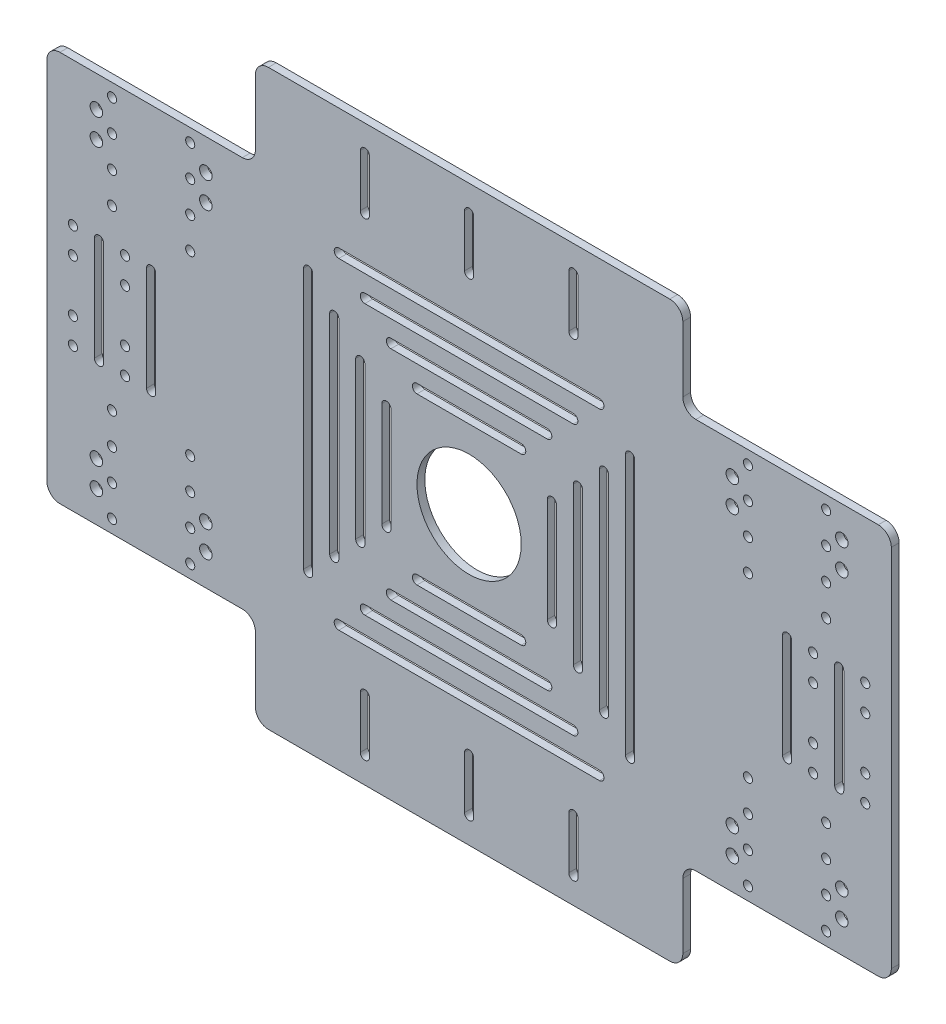
from build123d import *

# Parameters (mm, degrees)
SKETCH2_R           = 20
SKETCH2_R_2         = 1.75
SKETCH2_R_3         = 2.4
BOSS_EXTRUDE1_DEPTH = 3


with BuildPart() as part:
    # Sketch2 → Boss-Extrude1 (new body)
    with BuildSketch(Plane.XY):
        with BuildLine():
            Line((-124.210489142, 150.480737622), (-194.210489141, 150.480737622))
            ThreePointArc((-194.210489141, 150.480737622), (-197.746023047, 149.016271528), (-199.210489142, 145.480737623))
            Line((-199.210489142, 145.480737623), (-199.210489142, 76.980737622))
            Line((-199.210489142, 76.980737622), (-199.210489142, 5.480737623))
            ThreePointArc((-199.210489142, 5.480737623), (-197.746023048, 1.945203717), (-194.210489142, 0.480737622))
            Line((-194.210489142, 0.480737622), (-124.210489142, 0.480737622))
            ThreePointArc((-124.210489142, 0.480737622), (-120.674955236, -0.983728472), (-119.210489142, -4.519262377))
            Line((-119.210489142, -4.519262377), (-119.210489142, -29.519262378))
            ThreePointArc((-119.210489142, -29.519262378), (-117.746023048, -33.054796284), (-114.210489142, -34.519262378))
            Line((-114.210489142, -34.519262378), (-96.210489142, -34.519262378))
            Line((-96.210489142, -34.519262378), (39.789510858, -34.519262378))
            ThreePointArc((39.789510858, -34.519262378), (43.325044764, -33.054796284), (44.789510858, -29.519262378))
            Line((44.789510858, -29.519262378), (44.789510858, -4.519262378))
            ThreePointArc((44.789510858, -4.519262378), (46.253976952, -0.983728472), (49.789510858, 0.480737622))
            Line((49.789510858, 0.480737622), (119.789510858, 0.480737622))
            ThreePointArc((119.789510858, 0.480737622), (123.325044764, 1.945203716), (124.789510858, 5.480737622))
            Line((124.789510858, 5.480737622), (124.789510858, 76.980737622))
            Line((124.789510858, 76.980737622), (124.789510858, 145.480737622))
            ThreePointArc((124.789510858, 145.480737622), (123.325044764, 149.016271528), (119.789510858, 150.480737622))
            Line((119.789510858, 150.480737622), (49.789510858, 150.480737622))
            ThreePointArc((49.789510858, 150.480737622), (46.253976953, 151.945203716), (44.789510858, 155.480737622))
            Line((44.789510858, 155.480737622), (44.789510858, 180.480737622))
            ThreePointArc((44.789510858, 180.480737622), (43.325044764, 184.016271528), (39.789510858, 185.480737622))
            Line((39.789510858, 185.480737622), (-99.210489142, 185.480737622))
            Line((-99.210489142, 185.480737622), (-114.210489142, 185.480737622))
            ThreePointArc((-114.210489142, 185.480737622), (-117.746023048, 184.016271528), (-119.210489142, 180.480737622))
            Line((-119.210489142, 180.480737622), (-119.210489142, 155.480737622))
            ThreePointArc((-119.210489142, 155.480737622), (-120.674955236, 151.945203716), (-124.210489142, 150.480737622))
        make_face()
        with Locations((-37.210489142, 75.480737622)):
            Circle(SKETCH2_R, mode=Mode.SUBTRACT)
        with Locations((-144.210489142, 41.480737622)):
            Circle(SKETCH2_R_2, mode=Mode.SUBTRACT)
        with Locations((-144.210489142, 29.480737622)):
            Circle(SKETCH2_R_2, mode=Mode.SUBTRACT)
        with Locations((-144.210489142, 17.480737622)):
            Circle(SKETCH2_R_2, mode=Mode.SUBTRACT)
        with Locations((-144.210489142, 5.480737622)):
            Circle(SKETCH2_R_2, mode=Mode.SUBTRACT)
        with Locations((-138.210489142, 12.480737622)):
            Circle(SKETCH2_R_3, mode=Mode.SUBTRACT)
        with Locations((-138.210489142, 22.480737622)):
            Circle(SKETCH2_R_3, mode=Mode.SUBTRACT)
        with Locations((-180.210489142, 22.480737622)):
            Circle(SKETCH2_R_3, mode=Mode.SUBTRACT)
        with Locations((-180.210489142, 12.480737622)):
            Circle(SKETCH2_R_3, mode=Mode.SUBTRACT)
        with Locations((-174.210489142, 5.480737622)):
            Circle(SKETCH2_R_2, mode=Mode.SUBTRACT)
        with Locations((-174.210489142, 17.480737622)):
            Circle(SKETCH2_R_2, mode=Mode.SUBTRACT)
        with Locations((-174.210489142, 29.480737622)):
            Circle(SKETCH2_R_2, mode=Mode.SUBTRACT)
        with Locations((-174.210489142, 41.480737622)):
            Circle(SKETCH2_R_2, mode=Mode.SUBTRACT)
        with Locations((-189.210489142, 95.480737622)):
            Circle(SKETCH2_R_2, mode=Mode.SUBTRACT)
        with Locations((-189.210489142, 85.480737622)):
            Circle(SKETCH2_R_2, mode=Mode.SUBTRACT)
        with Locations((-189.210489142, 65.480737622)):
            Circle(SKETCH2_R_2, mode=Mode.SUBTRACT)
        with Locations((-189.210489142, 55.480737622)):
            Circle(SKETCH2_R_2, mode=Mode.SUBTRACT)
        with Locations((-169.210489142, 55.480737622)):
            Circle(SKETCH2_R_2, mode=Mode.SUBTRACT)
        with Locations((-169.210489142, 65.480737622)):
            Circle(SKETCH2_R_2, mode=Mode.SUBTRACT)
        with Locations((-169.210489142, 85.480737622)):
            Circle(SKETCH2_R_2, mode=Mode.SUBTRACT)
        with Locations((-169.210489142, 95.480737622)):
            Circle(SKETCH2_R_2, mode=Mode.SUBTRACT)
        with Locations((-138.210489142, 138.480737622)):
            Circle(SKETCH2_R_3, mode=Mode.SUBTRACT)
        with Locations((-144.210489142, 145.480737622)):
            Circle(SKETCH2_R_2, mode=Mode.SUBTRACT)
        with Locations((-144.210489142, 133.480737622)):
            Circle(SKETCH2_R_2, mode=Mode.SUBTRACT)
        with Locations((-138.210489142, 128.480737622)):
            Circle(SKETCH2_R_3, mode=Mode.SUBTRACT)
        with Locations((-144.210489142, 121.480737622)):
            Circle(SKETCH2_R_2, mode=Mode.SUBTRACT)
        with Locations((-144.210489142, 109.480737622)):
            Circle(SKETCH2_R_2, mode=Mode.SUBTRACT)
        with Locations((-174.210489142, 109.480737622)):
            Circle(SKETCH2_R_2, mode=Mode.SUBTRACT)
        with Locations((-174.210489142, 121.480737622)):
            Circle(SKETCH2_R_2, mode=Mode.SUBTRACT)
        with Locations((-180.210489142, 128.480737622)):
            Circle(SKETCH2_R_3, mode=Mode.SUBTRACT)
        with Locations((-174.210489142, 133.480737622)):
            Circle(SKETCH2_R_2, mode=Mode.SUBTRACT)
        with Locations((-180.210489142, 138.480737622)):
            Circle(SKETCH2_R_3, mode=Mode.SUBTRACT)
        with Locations((-174.210489142, 145.480737622)):
            Circle(SKETCH2_R_2, mode=Mode.SUBTRACT)
        with Locations((94.789510858, 55.480737622)):
            Circle(SKETCH2_R_2, mode=Mode.SUBTRACT)
        with Locations((94.789510858, 65.480737622)):
            Circle(SKETCH2_R_2, mode=Mode.SUBTRACT)
        with Locations((94.789510858, 95.480737622)):
            Circle(SKETCH2_R_2, mode=Mode.SUBTRACT)
        with Locations((94.789510858, 85.480737622)):
            Circle(SKETCH2_R_2, mode=Mode.SUBTRACT)
        with Locations((114.789510858, 55.480737622)):
            Circle(SKETCH2_R_2, mode=Mode.SUBTRACT)
        with Locations((114.789510858, 65.480737622)):
            Circle(SKETCH2_R_2, mode=Mode.SUBTRACT)
        with Locations((114.789510858, 85.480737622)):
            Circle(SKETCH2_R_2, mode=Mode.SUBTRACT)
        with Locations((114.789510858, 95.480737622)):
            Circle(SKETCH2_R_2, mode=Mode.SUBTRACT)
        with Locations((69.789510858, 121.480737622)):
            Circle(SKETCH2_R_2, mode=Mode.SUBTRACT)
        with Locations((69.789510858, 109.480737622)):
            Circle(SKETCH2_R_2, mode=Mode.SUBTRACT)
        with Locations((99.789510858, 109.480737622)):
            Circle(SKETCH2_R_2, mode=Mode.SUBTRACT)
        with Locations((99.789510858, 121.480737622)):
            Circle(SKETCH2_R_2, mode=Mode.SUBTRACT)
        with Locations((105.789510858, 128.480737622)):
            Circle(SKETCH2_R_3, mode=Mode.SUBTRACT)
        with Locations((99.789510858, 133.480737622)):
            Circle(SKETCH2_R_2, mode=Mode.SUBTRACT)
        with Locations((105.789510858, 138.480737622)):
            Circle(SKETCH2_R_3, mode=Mode.SUBTRACT)
        with Locations((99.789510858, 145.480737622)):
            Circle(SKETCH2_R_2, mode=Mode.SUBTRACT)
        with Locations((69.789510858, 145.480737622)):
            Circle(SKETCH2_R_2, mode=Mode.SUBTRACT)
        with Locations((69.789510858, 133.480737622)):
            Circle(SKETCH2_R_2, mode=Mode.SUBTRACT)
        with Locations((63.789510858, 138.480737622)):
            Circle(SKETCH2_R_3, mode=Mode.SUBTRACT)
        with Locations((63.789510858, 128.480737622)):
            Circle(SKETCH2_R_3, mode=Mode.SUBTRACT)
        with Locations((105.789510858, 22.480737622)):
            Circle(SKETCH2_R_3, mode=Mode.SUBTRACT)
        with Locations((105.789510858, 12.480737622)):
            Circle(SKETCH2_R_3, mode=Mode.SUBTRACT)
        with Locations((99.789510858, 5.480737622)):
            Circle(SKETCH2_R_2, mode=Mode.SUBTRACT)
        with Locations((99.789510858, 17.480737622)):
            Circle(SKETCH2_R_2, mode=Mode.SUBTRACT)
        with Locations((99.789510858, 29.480737622)):
            Circle(SKETCH2_R_2, mode=Mode.SUBTRACT)
        with Locations((99.789510858, 41.480737622)):
            Circle(SKETCH2_R_2, mode=Mode.SUBTRACT)
        with Locations((63.789510858, 22.480737622)):
            Circle(SKETCH2_R_3, mode=Mode.SUBTRACT)
        with Locations((63.789510858, 12.480737622)):
            Circle(SKETCH2_R_3, mode=Mode.SUBTRACT)
        with Locations((69.789510858, 5.480737622)):
            Circle(SKETCH2_R_2, mode=Mode.SUBTRACT)
        with Locations((69.789510858, 17.480737622)):
            Circle(SKETCH2_R_2, mode=Mode.SUBTRACT)
        with Locations((69.789510858, 29.480737622)):
            Circle(SKETCH2_R_2, mode=Mode.SUBTRACT)
        with Locations((69.789510858, 41.480737622)):
            Circle(SKETCH2_R_2, mode=Mode.SUBTRACT)
        with BuildLine():
            Line((-78.960489142, 175.480737622), (-78.960489142, 155.480737622))
            ThreePointArc((-78.960489142, 155.480737622), (-77.210489142, 153.730737622), (-75.460489142, 155.480737622))
            Line((-75.460489142, 155.480737622), (-75.460489142, 175.480737622))
            ThreePointArc((-75.460489142, 175.480737622), (-77.210489142, 177.230737622), (-78.960489142, 175.480737622))
        make_face(mode=Mode.SUBTRACT)
        with BuildLine():
            Line((-38.960489142, 175.480737622), (-38.960489142, 155.480737622))
            ThreePointArc((-38.960489142, 155.480737622), (-37.210489142, 153.730737622), (-35.460489142, 155.480737622))
            Line((-35.460489142, 155.480737622), (-35.460489142, 175.480737622))
            ThreePointArc((-35.460489142, 175.480737622), (-37.210489142, 177.230737622), (-38.960489142, 175.480737622))
        make_face(mode=Mode.SUBTRACT)
        with BuildLine():
            Line((4.539510858, 175.480737622), (4.539510858, 155.480737622))
            ThreePointArc((4.539510858, 155.480737622), (2.789510858, 153.730737622), (1.039510858, 155.480737622))
            Line((1.039510858, 155.480737622), (1.039510858, 175.480737622))
            ThreePointArc((1.039510858, 175.480737622), (2.789510858, 177.230737622), (4.539510858, 175.480737622))
        make_face(mode=Mode.SUBTRACT)
        with BuildLine():
            Line((-87.210489142, 138.980737622), (-37.210489142, 138.980737622))
            Line((-37.210489142, 138.980737622), (12.789510858, 138.980737622))
            ThreePointArc((12.789510858, 138.980737622), (14.539510858, 137.230737622), (12.789510858, 135.480737622))
            Line((12.789510858, 135.480737622), (-37.210489142, 135.480737622))
            Line((-37.210489142, 135.480737622), (-87.210489142, 135.480737622))
            ThreePointArc((-87.210489142, 135.480737622), (-88.960489142, 137.230737622), (-87.210489142, 138.980737622))
        make_face(mode=Mode.SUBTRACT)
        with BuildLine():
            Line((-77.210489142, 128.980737622), (-37.210489142, 128.980737622))
            Line((-37.210489142, 128.980737622), (2.789510858, 128.980737622))
            ThreePointArc((2.789510858, 128.980737622), (4.539510858, 127.230737622), (2.789510858, 125.480737622))
            Line((2.789510858, 125.480737622), (-37.210489142, 125.480737622))
            Line((-37.210489142, 125.480737622), (-77.210489142, 125.480737622))
            ThreePointArc((-77.210489142, 125.480737622), (-78.960489142, 127.230737622), (-77.210489142, 128.980737622))
        make_face(mode=Mode.SUBTRACT)
        with BuildLine():
            Line((-67.210489142, 118.980737622), (-37.210489142, 118.980737622))
            Line((-37.210489142, 118.980737622), (-7.210489142, 118.980737622))
            ThreePointArc((-7.210489142, 118.980737622), (-5.460489142, 117.230737622), (-7.210489142, 115.480737622))
            Line((-7.210489142, 115.480737622), (-37.210489142, 115.480737622))
            Line((-37.210489142, 115.480737622), (-67.210489142, 115.480737622))
            ThreePointArc((-67.210489142, 115.480737622), (-68.960489142, 117.230737622), (-67.210489142, 118.980737622))
        make_face(mode=Mode.SUBTRACT)
        with BuildLine():
            Line((-57.210489142, 108.980737622), (-37.210489142, 108.980737622))
            Line((-37.210489142, 108.980737622), (-17.210489142, 108.980737622))
            ThreePointArc((-17.210489142, 108.980737622), (-15.460489142, 107.230737622), (-17.210489142, 105.480737622))
            Line((-17.210489142, 105.480737622), (-37.210489142, 105.480737622))
            Line((-37.210489142, 105.480737622), (-57.210489142, 105.480737622))
            ThreePointArc((-57.210489142, 105.480737622), (-58.960489142, 107.230737622), (-57.210489142, 108.980737622))
        make_face(mode=Mode.SUBTRACT)
        with BuildLine():
            Line((-100.710489142, 25.480737622), (-100.710489142, 75.480737622))
            Line((-100.710489142, 75.480737622), (-100.710489142, 125.480737622))
            ThreePointArc((-100.710489142, 125.480737622), (-98.960489142, 127.230737622), (-97.210489142, 125.480737622))
            Line((-97.210489142, 125.480737622), (-97.210489142, 75.480737622))
            Line((-97.210489142, 75.480737622), (-97.210489142, 25.480737622))
            ThreePointArc((-97.210489142, 25.480737622), (-98.960489142, 23.730737622), (-100.710489142, 25.480737622))
        make_face(mode=Mode.SUBTRACT)
        with BuildLine():
            Line((-90.710489142, 115.480737622), (-90.710489142, 75.480737622))
            Line((-90.710489142, 75.480737622), (-90.710489142, 35.480737622))
            ThreePointArc((-90.710489142, 35.480737622), (-88.960489142, 33.730737622), (-87.210489142, 35.480737622))
            Line((-87.210489142, 35.480737622), (-87.210489142, 75.480737622))
            Line((-87.210489142, 75.480737622), (-87.210489142, 115.480737622))
            ThreePointArc((-87.210489142, 115.480737622), (-88.960489142, 117.230737622), (-90.710489142, 115.480737622))
        make_face(mode=Mode.SUBTRACT)
        with BuildLine():
            Line((-80.710489142, 105.480737622), (-80.710489142, 75.480737622))
            Line((-80.710489142, 75.480737622), (-80.710489142, 45.480737622))
            ThreePointArc((-80.710489142, 45.480737622), (-78.960489142, 43.730737622), (-77.210489142, 45.480737622))
            Line((-77.210489142, 45.480737622), (-77.210489142, 75.480737622))
            Line((-77.210489142, 75.480737622), (-77.210489142, 105.480737622))
            ThreePointArc((-77.210489142, 105.480737622), (-78.960489142, 107.230737622), (-80.710489142, 105.480737622))
        make_face(mode=Mode.SUBTRACT)
        with BuildLine():
            Line((-70.710489142, 95.480737622), (-70.710489142, 75.480737622))
            Line((-70.710489142, 75.480737622), (-70.710489142, 55.480737622))
            ThreePointArc((-70.710489142, 55.480737622), (-68.960489142, 53.730737622), (-67.210489142, 55.480737622))
            Line((-67.210489142, 55.480737622), (-67.210489142, 75.480737622))
            Line((-67.210489142, 75.480737622), (-67.210489142, 95.480737622))
            ThreePointArc((-67.210489142, 95.480737622), (-68.960489142, 97.230737622), (-70.710489142, 95.480737622))
        make_face(mode=Mode.SUBTRACT)
        with BuildLine():
            Line((-160.960489142, 95.480737622), (-160.960489142, 55.480737622))
            ThreePointArc((-160.960489142, 55.480737622), (-159.210489142, 53.730737622), (-157.460489142, 55.480737622))
            Line((-157.460489142, 55.480737622), (-157.460489142, 95.480737622))
            ThreePointArc((-157.460489142, 95.480737622), (-159.210489142, 97.230737622), (-160.960489142, 95.480737622))
        make_face(mode=Mode.SUBTRACT)
        with BuildLine():
            Line((-180.960489142, 95.480737622), (-180.960489142, 55.480737622))
            ThreePointArc((-180.960489142, 55.480737622), (-179.210489142, 53.730737622), (-177.460489142, 55.480737622))
            Line((-177.460489142, 55.480737622), (-177.460489142, 95.480737622))
            ThreePointArc((-177.460489142, 95.480737622), (-179.210489142, 97.230737622), (-180.960489142, 95.480737622))
        make_face(mode=Mode.SUBTRACT)
        with BuildLine():
            Line((-57.210489142, 45.480737622), (-37.210489142, 45.480737622))
            Line((-37.210489142, 45.480737622), (-17.210489142, 45.480737622))
            ThreePointArc((-17.210489142, 45.480737622), (-15.460489142, 43.730737622), (-17.210489142, 41.980737622))
            Line((-17.210489142, 41.980737622), (-37.210489142, 41.980737622))
            Line((-37.210489142, 41.980737622), (-57.210489142, 41.980737622))
            ThreePointArc((-57.210489142, 41.980737622), (-58.960489142, 43.730737622), (-57.210489142, 45.480737622))
        make_face(mode=Mode.SUBTRACT)
        with BuildLine():
            Line((-67.210489142, 35.480737622), (-37.210489142, 35.480737622))
            Line((-37.210489142, 35.480737622), (-7.210489142, 35.480737622))
            ThreePointArc((-7.210489142, 35.480737622), (-5.460489142, 33.730737622), (-7.210489142, 31.980737622))
            Line((-7.210489142, 31.980737622), (-37.210489142, 31.980737622))
            Line((-37.210489142, 31.980737622), (-67.210489142, 31.980737622))
            ThreePointArc((-67.210489142, 31.980737622), (-68.960489142, 33.730737622), (-67.210489142, 35.480737622))
        make_face(mode=Mode.SUBTRACT)
        with BuildLine():
            Line((-77.210489142, 25.480737622), (-37.210489142, 25.480737622))
            Line((-37.210489142, 25.480737622), (2.789510858, 25.480737622))
            ThreePointArc((2.789510858, 25.480737622), (4.539510858, 23.730737622), (2.789510858, 21.980737622))
            Line((2.789510858, 21.980737622), (-37.210489142, 21.980737622))
            Line((-37.210489142, 21.980737622), (-77.210489142, 21.980737622))
            ThreePointArc((-77.210489142, 21.980737622), (-78.960489142, 23.730737622), (-77.210489142, 25.480737622))
        make_face(mode=Mode.SUBTRACT)
        with BuildLine():
            Line((-87.210489142, 15.480737622), (-37.210489142, 15.480737622))
            Line((-37.210489142, 15.480737622), (12.789510858, 15.480737622))
            ThreePointArc((12.789510858, 15.480737622), (14.539510858, 13.730737622), (12.789510858, 11.980737622))
            Line((12.789510858, 11.980737622), (-37.210489142, 11.980737622))
            Line((-37.210489142, 11.980737622), (-87.210489142, 11.980737622))
            ThreePointArc((-87.210489142, 11.980737622), (-88.960489142, 13.730737622), (-87.210489142, 15.480737622))
        make_face(mode=Mode.SUBTRACT)
        with BuildLine():
            Line((22.789510858, 25.480737622), (22.789510858, 75.480737622))
            Line((22.789510858, 75.480737622), (22.789510858, 125.480737622))
            ThreePointArc((22.789510858, 125.480737622), (24.539510858, 127.230737622), (26.289510858, 125.480737622))
            Line((26.289510858, 125.480737622), (26.289510858, 75.480737622))
            Line((26.289510858, 75.480737622), (26.289510858, 25.480737622))
            ThreePointArc((26.289510858, 25.480737622), (24.539510858, 23.730737622), (22.789510858, 25.480737622))
        make_face(mode=Mode.SUBTRACT)
        with BuildLine():
            Line((12.789510858, 35.480737622), (12.789510858, 75.480737622))
            Line((12.789510858, 75.480737622), (12.789510858, 115.480737622))
            ThreePointArc((12.789510858, 115.480737622), (14.539510858, 117.230737622), (16.289510858, 115.480737622))
            Line((16.289510858, 115.480737622), (16.289510858, 75.480737622))
            Line((16.289510858, 75.480737622), (16.289510858, 35.480737622))
            ThreePointArc((16.289510858, 35.480737622), (14.539510858, 33.730737622), (12.789510858, 35.480737622))
        make_face(mode=Mode.SUBTRACT)
        with BuildLine():
            Line((2.789510858, 45.480737622), (2.789510858, 75.480737622))
            Line((2.789510858, 75.480737622), (2.789510858, 105.480737622))
            ThreePointArc((2.789510858, 105.480737622), (4.539510858, 107.230737622), (6.289510858, 105.480737622))
            Line((6.289510858, 105.480737622), (6.289510858, 75.480737622))
            Line((6.289510858, 75.480737622), (6.289510858, 45.480737622))
            ThreePointArc((6.289510858, 45.480737622), (4.539510858, 43.730737622), (2.789510858, 45.480737622))
        make_face(mode=Mode.SUBTRACT)
        with BuildLine():
            Line((-7.210489142, 55.480737622), (-7.210489142, 75.480737622))
            Line((-7.210489142, 75.480737622), (-7.210489142, 95.480737622))
            ThreePointArc((-7.210489142, 95.480737622), (-5.460489142, 97.230737622), (-3.710489142, 95.480737622))
            Line((-3.710489142, 95.480737622), (-3.710489142, 75.480737622))
            Line((-3.710489142, 75.480737622), (-3.710489142, 55.480737622))
            ThreePointArc((-3.710489142, 55.480737622), (-5.460489142, 53.730737622), (-7.210489142, 55.480737622))
        make_face(mode=Mode.SUBTRACT)
        with BuildLine():
            Line((1.039510858, -24.519262378), (1.039510858, -4.519262378))
            ThreePointArc((1.039510858, -4.519262378), (2.789510858, -2.769262378), (4.539510858, -4.519262378))
            Line((4.539510858, -4.519262378), (4.539510858, -24.519262378))
            ThreePointArc((4.539510858, -24.519262378), (2.789510858, -26.269262378), (1.039510858, -24.519262378))
        make_face(mode=Mode.SUBTRACT)
        with BuildLine():
            Line((-38.960489142, -24.519262378), (-38.960489142, -4.519262378))
            ThreePointArc((-38.960489142, -4.519262378), (-37.210489142, -2.769262378), (-35.460489142, -4.519262378))
            Line((-35.460489142, -4.519262378), (-35.460489142, -24.519262378))
            ThreePointArc((-35.460489142, -24.519262378), (-37.210489142, -26.269262378), (-38.960489142, -24.519262378))
        make_face(mode=Mode.SUBTRACT)
        with BuildLine():
            Line((-78.960489142, -24.519262378), (-78.960489142, -4.519262378))
            ThreePointArc((-78.960489142, -4.519262378), (-77.210489142, -2.769262378), (-75.460489142, -4.519262378))
            Line((-75.460489142, -4.519262378), (-75.460489142, -24.519262378))
            ThreePointArc((-75.460489142, -24.519262378), (-77.210489142, -26.269262378), (-78.960489142, -24.519262378))
        make_face(mode=Mode.SUBTRACT)
        with BuildLine():
            Line((106.539510858, 95.480737622), (106.539510858, 55.480737622))
            ThreePointArc((106.539510858, 55.480737622), (104.789510858, 53.730737622), (103.039510858, 55.480737622))
            Line((103.039510858, 55.480737622), (103.039510858, 95.480737622))
            ThreePointArc((103.039510858, 95.480737622), (104.789510858, 97.230737622), (106.539510858, 95.480737622))
        make_face(mode=Mode.SUBTRACT)
        with BuildLine():
            Line((83.039510858, 95.480737622), (83.039510858, 55.480737622))
            ThreePointArc((83.039510858, 55.480737622), (84.789510858, 53.730737622), (86.539510858, 55.480737622))
            Line((86.539510858, 55.480737622), (86.539510858, 95.480737622))
            ThreePointArc((86.539510858, 95.480737622), (84.789510858, 97.230737622), (83.039510858, 95.480737622))
        make_face(mode=Mode.SUBTRACT)
    extrude(amount=BOSS_EXTRUDE1_DEPTH)


solid = part.part
